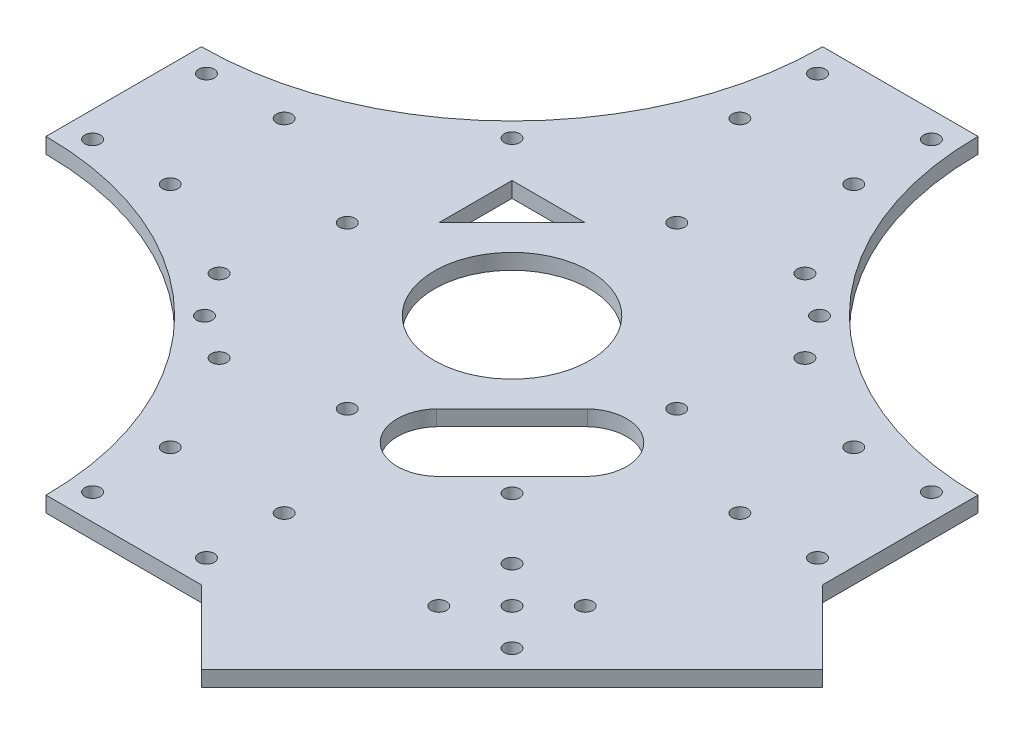
from build123d import *

# Parameters (mm, degrees)
SKETCH_1_R           = 1.25
EXTRUDE_1_DEPTH      = 3
SKETCH_2_R           = 1.5
CUT_EXTRUDE_1_DEPTH  = 3
CUT_EXTRUDE_2_DEPTH  = 3
CUT_EXTRUDE_3_DEPTH  = 3
CUT_EXTRUDE_4_DEPTH  = 10
SKETCH_6_R           = 1.5
CUT_EXTRUDE_5_DEPTH  = 10
SKETCH_7_R           = 1.5
CUT_EXTRUDE_8_DEPTH  = 10
SKETCH_8_R           = 1.5
CUT_EXTRUDE_9_DEPTH  = 10
SKETCH_9_R           = 15
CUT_EXTRUDE_10_DEPTH = 10
EXTRUDE_START        = -3
EXTRUDE_2_DEPTH      = 3
SKETCH_11_R          = 1.5
CUT_EXTRUDE_11_DEPTH = 3
SKETCH_12_R          = 1.5
CUT_EXTRUDE_12_DEPTH = 3


with BuildPart() as part:
    # 草图1 → 凸台-拉伸1 (new body)
    # profile 1 of 4: a face of its own
    with BuildSketch(Plane(origin=(0, 0, 0), x_dir=(1, 0, 0), z_dir=(0, 1, 0))):
        with BuildLine():
            ThreePointArc((75, -15), (32.573593129, -32.573593129), (15, -75))
            Line((15, -75), (0, -75))
            Line((0, -75), (0, 0))
            Line((0, 0), (75, 0))
            Line((75, 0), (75, -15))
        make_face()
        with Locations(Location((11, -70, 0), (0, 0, 270))):
            Circle(SKETCH_1_R, mode=Mode.SUBTRACT)
        with Locations(Location((70, -11, 0), (0, 0, 270))):
            Circle(SKETCH_1_R, mode=Mode.SUBTRACT)
    # profile 2 of 4: a face of its own
    with BuildSketch(Plane(origin=(0, 0, 0), x_dir=(1, 0, 0), z_dir=(0, 1, 0))):
        with BuildLine():
            ThreePointArc((-15, -75), (-32.573593129, -32.573593129), (-75, -15))
            Line((-75, -15), (-75, 0))
            Line((-75, 0), (0, 0))
            Line((0, 0), (0, -75))
            Line((0, -75), (-15, -75))
        make_face()
        with Locations(Location((-70, -11, 0), (0, 0, 270))):
            Circle(SKETCH_1_R, mode=Mode.SUBTRACT)
        with Locations(Location((-11, -70, 0), (0, 0, 270))):
            Circle(SKETCH_1_R, mode=Mode.SUBTRACT)
    # profile 3 of 4: a face of its own
    with BuildSketch(Plane(origin=(0, 0, 0), x_dir=(1, 0, 0), z_dir=(0, 1, 0))):
        with BuildLine():
            ThreePointArc((-75, 15), (-32.573593129, 32.573593129), (-15, 75))
            Line((-15, 75), (0, 75))
            Line((0, 75), (0, 0))
            Line((0, 0), (-75, 0))
            Line((-75, 0), (-75, 15))
        make_face()
        with Locations(Location((-11, 70, 0), (0, 0, 270))):
            Circle(SKETCH_1_R, mode=Mode.SUBTRACT)
        with Locations(Location((-70, 11, 0), (0, 0, 270))):
            Circle(SKETCH_1_R, mode=Mode.SUBTRACT)
    # profile 4 of 4: a face of its own
    with BuildSketch(Plane(origin=(0, 0, 0), x_dir=(1, 0, 0), z_dir=(0, 1, 0))):
        with BuildLine():
            ThreePointArc((15, 75), (32.573593129, 32.573593129), (75, 15))
            Line((75, 15), (75, 0))
            Line((75, 0), (0, 0))
            Line((0, 0), (0, 75))
            Line((0, 75), (15, 75))
        make_face()
        with Locations(Location((70, 11, 0), (0, 0, 270))):
            Circle(SKETCH_1_R, mode=Mode.SUBTRACT)
        with Locations(Location((11, 70, 0), (0, 0, 270))):
            Circle(SKETCH_1_R, mode=Mode.SUBTRACT)
    extrude(amount=EXTRUDE_1_DEPTH)

    # 草图2 → 切除-拉伸1 (cut)
    with BuildSketch(Plane.XZ):
        with Locations(Location((0.353553391, -31.466251763, 0), (0, 0, 270))):
            Circle(SKETCH_2_R)
        with Locations(Location((31.466251763, -0.353553391, 0), (0, 0, 270))):
            Circle(SKETCH_2_R)
        with Locations(Location((-0.353553391, 31.466251763, 0), (0, 0, 90))):
            Circle(SKETCH_2_R)
        with Locations(Location((-31.466251763, 0.353553391, 0), (0, 0, 90))):
            Circle(SKETCH_2_R)
    extrude(amount=-CUT_EXTRUDE_1_DEPTH, mode=Mode.SUBTRACT)

    # 草图3 → 切除-拉伸2 (cut)
    with BuildSketch(Plane(origin=(0, 3, 0), x_dir=(1, 0, 0), z_dir=(0, 1, 0))):
        Polygon((-15.556349186, 15.556349186), (-12.02081528, 19.091883092), (-22.627416998, 22.627416998), align=None)
        Polygon((-19.091883092, 12.02081528), (-15.556349186, 15.556349186), (-22.627416998, 22.627416998), align=None)
    extrude(amount=-CUT_EXTRUDE_2_DEPTH, mode=Mode.SUBTRACT)

    # 草图4 → 切除-拉伸3 (cut)
    with BuildSketch(Plane(origin=(0, 3, 0), x_dir=(1, 0, 0), z_dir=(0, 1, 0))):
        with BuildLine():
            ThreePointArc((33.944668714, -19.80253309), (34.043922781, -8.582763971), (22.827665534, -8.285032838))
            Line((22.827665534, -8.285032838), (15.556349186, -15.556349186))
            Line((15.556349186, -15.556349186), (8.285032838, -22.827665534))
            ThreePointArc((8.285032838, -22.827665534), (8.582763971, -34.043922781), (19.80253309, -33.944668714))
            Line((19.80253309, -33.944668714), (33.944668714, -19.80253309))
        make_face()
    extrude(amount=-CUT_EXTRUDE_3_DEPTH, mode=Mode.SUBTRACT)

    # 草图5 → 切除-拉伸4 (cut)
    with BuildSketch(Plane(origin=(0, 3, 0), x_dir=(1, 0, 0), z_dir=(0, 1, 0))):
        Polygon((-22.627416998, 8.485281374), (-22.627416998, 22.627416998), (-19.091883092, 12.02081528), align=None)
        Polygon((-12.02081528, 19.091883092), (-22.627416998, 22.627416998), (-8.485281374, 22.627416998), align=None)
    extrude(amount=-CUT_EXTRUDE_4_DEPTH, mode=Mode.SUBTRACT)

    # 草图6 → 切除-拉伸5 (cut)
    with BuildSketch(Plane(origin=(0, 3, 0), x_dir=(1, 0, 0), z_dir=(0, 1, 0))):
        with Locations(Location((-35.355339059, -21.213203436, 0), (0, 0, 270))):
            Circle(SKETCH_6_R)
        with Locations(Location((-21.213203436, -35.355339059, 0), (0, 0, 270))):
            Circle(SKETCH_6_R)
        with Locations(Location((35.355339059, 21.213203436, 0), (0, 0, 270))):
            Circle(SKETCH_6_R)
        with Locations(Location((21.213203436, 35.355339059, 0), (0, 0, 270))):
            Circle(SKETCH_6_R)
    extrude(amount=-CUT_EXTRUDE_5_DEPTH, mode=Mode.SUBTRACT)

    # 草图7 → 切除-拉伸8 (cut)
    with BuildSketch(Plane(origin=(0, 3, 0), x_dir=(1, 0, 0), z_dir=(0, 1, 0))):
        with Locations(Location((-29.69848481, 29.69848481, 0), (0, 0, 270))):
            Circle(SKETCH_7_R)
        with Locations(Location((29.69848481, 29.69848481, 0), (0, 0, 270))):
            Circle(SKETCH_7_R)
        with Locations(Location((29.69848481, -29.69848481, 0), (0, 0, 270))):
            Circle(SKETCH_7_R)
        with Locations(Location((-29.69848481, -29.69848481, 0), (0, 0, 270))):
            Circle(SKETCH_7_R)
    extrude(amount=-CUT_EXTRUDE_8_DEPTH, mode=Mode.SUBTRACT)

    # 草图8 → 切除-拉伸9 (cut)
    with BuildSketch(Plane(origin=(0, 3, 0), x_dir=(1, 0, 0), z_dir=(0, 1, 0))):
        with Locations(Location((-11, 55, 0), (0, 0, 270))):
            Circle(SKETCH_8_R)
        with Locations(Location((11, 55, 0), (0, 0, 270))):
            Circle(SKETCH_8_R)
        with Locations(Location((55, 11, 0), (0, 0, 270))):
            Circle(SKETCH_8_R)
        with Locations(Location((55, -11, 0), (0, 0, 270))):
            Circle(SKETCH_8_R)
        with Locations(Location((11, -55, 0), (0, 0, 270))):
            Circle(SKETCH_8_R)
        with Locations(Location((-11, -55, 0), (0, 0, 270))):
            Circle(SKETCH_8_R)
        with Locations(Location((-55, -11, 0), (0, 0, 270))):
            Circle(SKETCH_8_R)
        with Locations(Location((-55, 11, 0), (0, 0, 270))):
            Circle(SKETCH_8_R)
    extrude(amount=-CUT_EXTRUDE_9_DEPTH, mode=Mode.SUBTRACT)

    # 草图9 → 切除-拉伸10 (cut)
    with BuildSketch(Plane(origin=(0, 3, 0), x_dir=(1, 0, 0), z_dir=(0, 1, 0))):
        with Locations(Location((0, 0, 0), (0, 0, 270))):
            Circle(SKETCH_9_R)
    extrude(amount=-CUT_EXTRUDE_10_DEPTH, mode=Mode.SUBTRACT)

    # 草图10 → 凸台-拉伸2 (add)
    with BuildSketch(Plane(origin=(0, 3, 0), x_dir=(1, 0, 0), z_dir=(0, 1, 0)).offset(EXTRUDE_START)):
        Polygon((89.142135624, -29.142135624), (29.142135624, -89.142135624), (15, -75), (75, -15), align=None)
        with BuildLine():
            Line((75, -15), (15, -75))
            ThreePointArc((15, -75), (32.573593129, -32.573593129), (75, -15))
        make_face()
    extrude(amount=EXTRUDE_2_DEPTH)

    # 草图11 → 切除-拉伸11 (cut)
    with BuildSketch(Plane(origin=(0, 3, 0), x_dir=(1, 0, 0), z_dir=(0, 1, 0))):
        with Locations(Location((11, 70, 0), (0, 0, 270))):
            Circle(SKETCH_11_R)
        with Locations(Location((-11, 70, 0), (0, 0, 270))):
            Circle(SKETCH_11_R)
        with Locations(Location((70, 11, 0), (0, 0, 270))):
            Circle(SKETCH_11_R)
        with Locations(Location((70, -11, 0), (0, 0, 270))):
            Circle(SKETCH_11_R)
        with Locations(Location((11, -70, 0), (0, 0, 270))):
            Circle(SKETCH_11_R)
        with Locations(Location((-11, -70, 0), (0, 0, 270))):
            Circle(SKETCH_11_R)
        with Locations(Location((-70, -11, 0), (0, 0, 270))):
            Circle(SKETCH_11_R)
        with Locations(Location((-70, 11, 0), (0, 0, 270))):
            Circle(SKETCH_11_R)
    extrude(amount=-CUT_EXTRUDE_11_DEPTH, mode=Mode.SUBTRACT)

    # 草图12 → 切除-拉伸12 (cut)
    with BuildSketch(Plane(origin=(0, 3, 0), x_dir=(1, 0, 0), z_dir=(0, 1, 0))):
        with Locations(Location((48.535533906, -48.535533906, 0), (0, 0, 270))):
            Circle(SKETCH_12_R)
        with Locations(Location((55.606601718, -41.464466094, 0), (0, 0, 270))):
            Circle(SKETCH_12_R)
        with Locations(Location((55.606601718, -55.606601718, 0), (0, 0, 270))):
            Circle(SKETCH_12_R)
        with Locations(Location((41.464466094, -55.606601718, 0), (0, 0, 270))):
            Circle(SKETCH_12_R)
        with Locations(Location((41.464466094, -41.464466094, 0), (0, 0, 270))):
            Circle(SKETCH_12_R)
    extrude(amount=-CUT_EXTRUDE_12_DEPTH, mode=Mode.SUBTRACT)


solid = part.part
